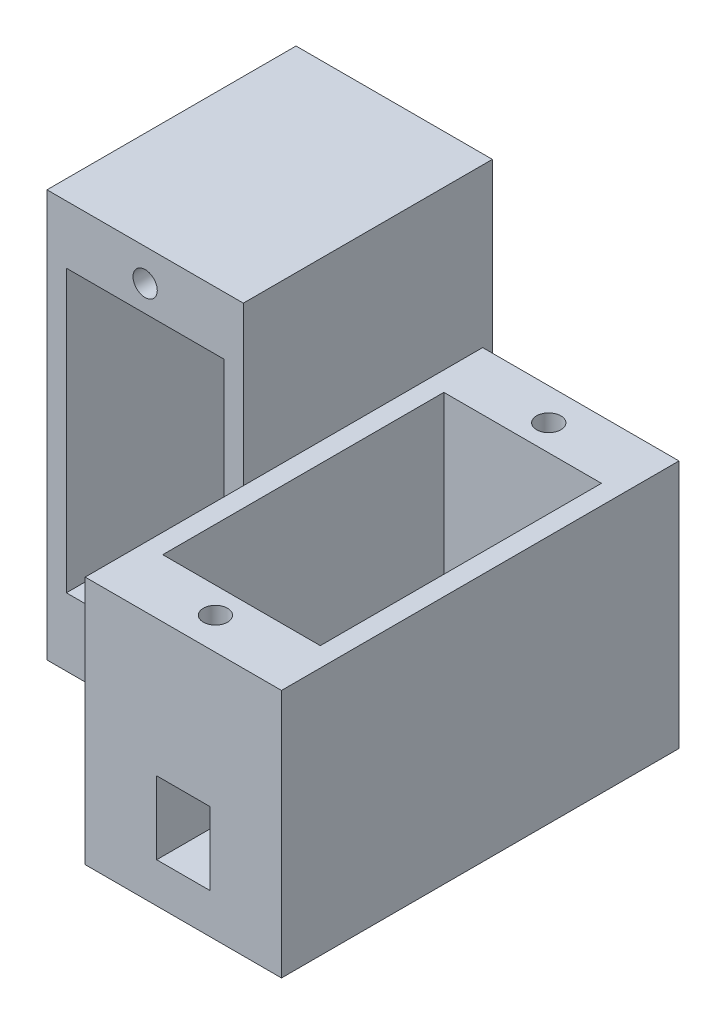
from build123d import *

# Parameters (mm, degrees)
BOSS_EXTRUDE1_START = 17.075
SKETCH1_W           = 16.2
SKETCH1_H           = 32.8
BOSS_EXTRUDE1_DEPTH = 10.275
BOSS_EXTRUDE2_START = -12.425
SKETCH2_W           = 16.2
SKETCH2_H           = 32.8
BOSS_EXTRUDE2_DEPTH = 10.275
BOSS_EXTRUDE3_START = 7.3
SKETCH3_W           = 16.2
SKETCH3_H           = 20.55
BOSS_EXTRUDE3_DEPTH = 0.5
CUT_EXTRUDE1_START  = 18.725
SKETCH4_W           = 13
SKETCH4_H           = 23.2
CUT_EXTRUDE1_DEPTH  = 8.625
CUT_EXTRUDE2_START  = 24.35
SKETCH5_R           = 1
CUT_EXTRUDE2_DEPTH  = 3
CUT_EXTRUDE3_START  = 24.35
SKETCH6_R           = 1
CUT_EXTRUDE3_DEPTH  = 3
CUT_EXTRUDE4_START  = 8.1
SKETCH7_R           = 3.15
CUT_EXTRUDE4_DEPTH  = 1.3
CUT_EXTRUDE5_START  = 8.5
SKETCH8_W           = 4.4
SKETCH8_H           = 6
CUT_EXTRUDE5_DEPTH  = 2.4
CUT_EXTRUDE6_START  = -10.775
SKETCH9_W           = 13
SKETCH9_H           = 23.2
CUT_EXTRUDE6_DEPTH  = 8.625
CUT_EXTRUDE7_START  = -5.15
SKETCH10_R          = 1
CUT_EXTRUDE7_DEPTH  = 3
CUT_EXTRUDE8_START  = -5.15
SKETCH11_R          = 1
CUT_EXTRUDE8_DEPTH  = 3
CUT_EXTRUDE9_START  = -21.4
SKETCH12_R          = 3.15
CUT_EXTRUDE9_DEPTH  = 1.3
CUT_EXTRUDE10_START = 10
SKETCH13_W          = 4.4
SKETCH13_H          = 6
CUT_EXTRUDE10_DEPTH = 2.4


with BuildPart() as part:
    # Sketch1 → Boss-Extrude1 (new, symmetric)
    with BuildSketch(Plane(origin=(0, 0, 0), x_dir=(1, 0, 0), z_dir=(0, 1, 0)).offset(BOSS_EXTRUDE1_START)):
        with Locations((0, 5.5)):
            Rectangle(SKETCH1_W, SKETCH1_H)
    extrude(amount=BOSS_EXTRUDE1_DEPTH, both=True)

    # Sketch2 → Boss-Extrude2 (add, symmetric)
    with BuildSketch(Plane.XY.offset(BOSS_EXTRUDE2_START)):
        with Locations((-16.2, 24)):
            Rectangle(SKETCH2_W, SKETCH2_H)
    extrude(amount=BOSS_EXTRUDE2_DEPTH, both=True)

    # Sketch3 → Boss-Extrude3 (add, symmetric)
    with BuildSketch(Plane(origin=(0, 0, 0), x_dir=(1, 0, 0), z_dir=(0, 1, 0)).offset(BOSS_EXTRUDE3_START)):
        with Locations((-16.2, 12.425)):
            Rectangle(SKETCH3_W, SKETCH3_H)
    extrude(amount=BOSS_EXTRUDE3_DEPTH, both=True)

    # Sketch4 → Cut-Extrude1 (cut, symmetric)
    with BuildSketch(Plane(origin=(0, 0, 0), x_dir=(1, 0, 0), z_dir=(0, 1, 0)).offset(CUT_EXTRUDE1_START)):
        with Locations((0, 5.5)):
            Rectangle(SKETCH4_W, SKETCH4_H)
    extrude(amount=CUT_EXTRUDE1_DEPTH, both=True, mode=Mode.SUBTRACT)

    # Sketch5 → Cut-Extrude2 (cut, symmetric)
    with BuildSketch(Plane(origin=(0, 0, 0), x_dir=(1, 0, 0), z_dir=(0, 1, 0)).offset(CUT_EXTRUDE2_START)):
        with Locations(Location((0, 19.25, 0), (0, 0, 270))):
            Circle(SKETCH5_R)
    extrude(amount=CUT_EXTRUDE2_DEPTH, both=True, mode=Mode.SUBTRACT)

    # Sketch6 → Cut-Extrude3 (cut, symmetric)
    with BuildSketch(Plane(origin=(0, 0, 0), x_dir=(1, 0, 0), z_dir=(0, 1, 0)).offset(CUT_EXTRUDE3_START)):
        with Locations(Location((0, -8.25, 0), (0, 0, 270))):
            Circle(SKETCH6_R)
    extrude(amount=CUT_EXTRUDE3_DEPTH, both=True, mode=Mode.SUBTRACT)

    # Sketch7 → Cut-Extrude4 (cut, symmetric)
    with BuildSketch(Plane(origin=(0, 0, 0), x_dir=(1, 0, 0), z_dir=(0, 1, 0)).offset(CUT_EXTRUDE4_START)):
        with Locations(Location((0, 0, 0), (0, 0, 270))):
            Circle(SKETCH7_R)
    extrude(amount=CUT_EXTRUDE4_DEPTH, both=True, mode=Mode.SUBTRACT)

    # Sketch8 → Cut-Extrude5 (cut, symmetric)
    with BuildSketch(Plane.XY.offset(CUT_EXTRUDE5_START)):
        with Locations((0, 13.1)):
            Rectangle(SKETCH8_W, SKETCH8_H)
    extrude(amount=CUT_EXTRUDE5_DEPTH, both=True, mode=Mode.SUBTRACT)

    # Sketch9 → Cut-Extrude6 (cut, symmetric)
    with BuildSketch(Plane.XY.offset(CUT_EXTRUDE6_START)):
        with Locations((-16.2, 24)):
            Rectangle(SKETCH9_W, SKETCH9_H)
    extrude(amount=CUT_EXTRUDE6_DEPTH, both=True, mode=Mode.SUBTRACT)

    # Sketch10 → Cut-Extrude7 (cut, symmetric)
    with BuildSketch(Plane.XY.offset(CUT_EXTRUDE7_START)):
        with Locations((-16.2, 37.75)):
            Circle(SKETCH10_R)
    extrude(amount=CUT_EXTRUDE7_DEPTH, both=True, mode=Mode.SUBTRACT)

    # Sketch11 → Cut-Extrude8 (cut, symmetric)
    with BuildSketch(Plane.XY.offset(CUT_EXTRUDE8_START)):
        with Locations((-16.2, 10.25)):
            Circle(SKETCH11_R)
    extrude(amount=CUT_EXTRUDE8_DEPTH, both=True, mode=Mode.SUBTRACT)

    # Sketch12 → Cut-Extrude9 (cut, symmetric)
    with BuildSketch(Plane.XY.offset(CUT_EXTRUDE9_START)):
        with Locations((-16.2, 18.5)):
            Circle(SKETCH12_R)
    extrude(amount=CUT_EXTRUDE9_DEPTH, both=True, mode=Mode.SUBTRACT)

    # Sketch13 → Cut-Extrude10 (cut, symmetric)
    with BuildSketch(Plane(origin=(0, 0, 0), x_dir=(1, 0, 0), z_dir=(0, 1, 0)).offset(CUT_EXTRUDE10_START)):
        with Locations((-16.2, 16.4)):
            Rectangle(SKETCH13_W, SKETCH13_H)
    extrude(amount=CUT_EXTRUDE10_DEPTH, both=True, mode=Mode.SUBTRACT)


solid = part.part
